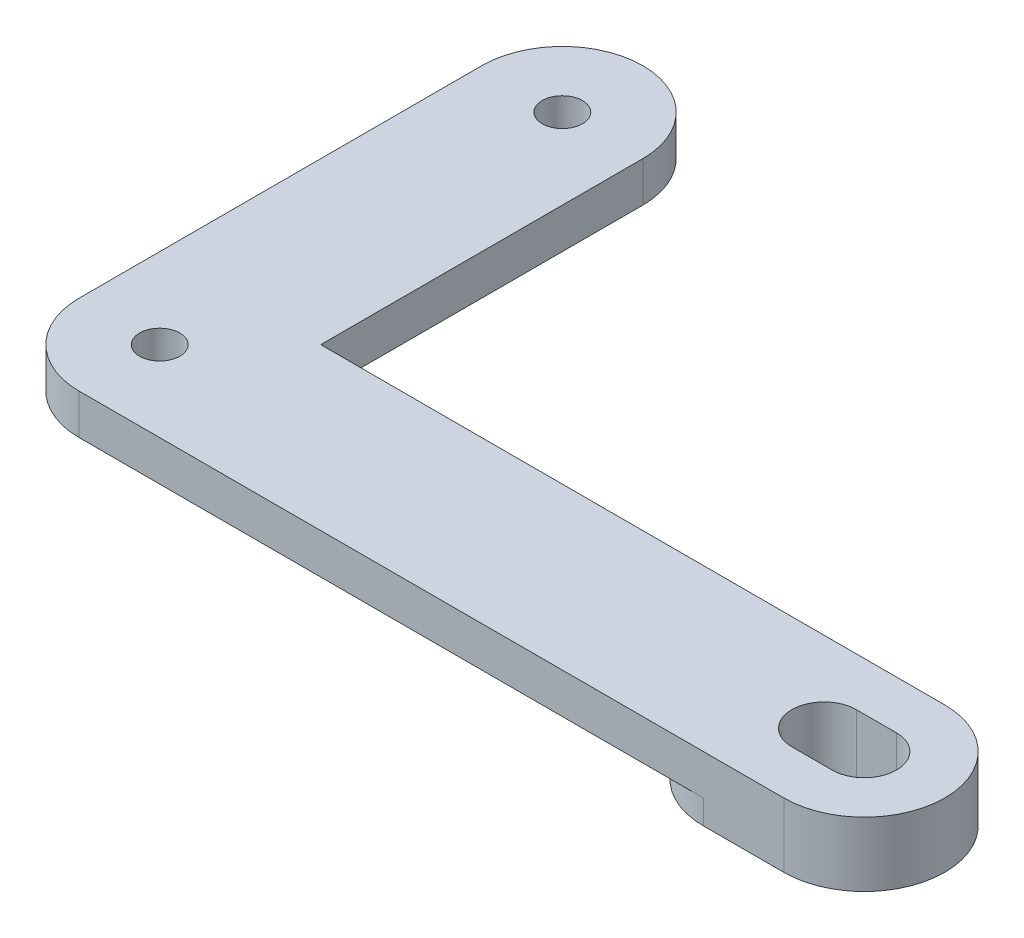
from build123d import *

# Parameters (mm, degrees)
SKETCH1_R           = 2.5
BOSS_EXTRUDE1_DEPTH = 8
BOSS_EXTRUDE2_START = -5
SKETCH2_R           = 2.5
BOSS_EXTRUDE2_DEPTH = 5
SKETCH3_OUTSIDE_W   = 135.206
SKETCH3_OUTSIDE_H   = 97.706
CUT_EXTRUDE2_DEPTH  = 3


with BuildPart() as part:
    # Sketch1 → Boss-Extrude1 (new body)
    with BuildSketch(Plane(origin=(0, 0, 0), x_dir=(1, 0, 0), z_dir=(0, 1, 0))):
        with BuildLine():
            Line((0, 10), (87.5, 10))
            ThreePointArc((87.5, 10), (97.5, 0), (87.5, -10))
            Line((87.5, -10), (0, -10))
            ThreePointArc((0, -10), (-10, 0), (0, 10))
        make_face()
        with Locations(Location((0, 0, 0), (0, 0, 270))):
            Circle(SKETCH1_R, mode=Mode.SUBTRACT)
        with BuildLine():
            Line((87.5, -4), (82.5, -4))
            ThreePointArc((82.5, -4), (78.5, 0), (82.5, 4))
            Line((82.5, 4), (87.5, 4))
            ThreePointArc((87.5, 4), (91.5, 0), (87.5, -4))
        make_face(mode=Mode.SUBTRACT)
    extrude(amount=BOSS_EXTRUDE1_DEPTH)

    # Sketch2 → Boss-Extrude2 (add)
    with BuildSketch(Plane(origin=(0, 8, 0), x_dir=(1, 0, 0), z_dir=(0, 1, 0)).offset(BOSS_EXTRUDE2_START)):
        with BuildLine():
            Line((-10, 0), (-10, 50))
            ThreePointArc((-10, 50), (0, 60), (10, 50))
            Line((10, 50), (10, 0))
            ThreePointArc((10, 0), (0, -10), (-10, 0))
        make_face()
        with Locations(Location((0, 0, 0), (0, 0, 270))):
            Circle(SKETCH2_R, mode=Mode.SUBTRACT)
        with Locations(Location((0, 50, 0), (0, 0, 270))):
            Circle(SKETCH2_R, mode=Mode.SUBTRACT)
    extrude(amount=BOSS_EXTRUDE2_DEPTH)

    # Sketch3 outside → Cut-Extrude2 (cut)
    with BuildSketch(Plane.XZ):
        with Locations((43.75, -25)):
            Rectangle(SKETCH3_OUTSIDE_W, SKETCH3_OUTSIDE_H)
        with BuildLine():
            Line((87.5, -10), (77.5, -10))
            ThreePointArc((77.5, -10), (67.5, 0), (77.5, 10))
            Line((77.5, 10), (87.5, 10))
            ThreePointArc((87.5, 10), (97.5, 0), (87.5, -10))
        make_face(mode=Mode.SUBTRACT)
    extrude(amount=-CUT_EXTRUDE2_DEPTH, mode=Mode.SUBTRACT)


solid = part.part
